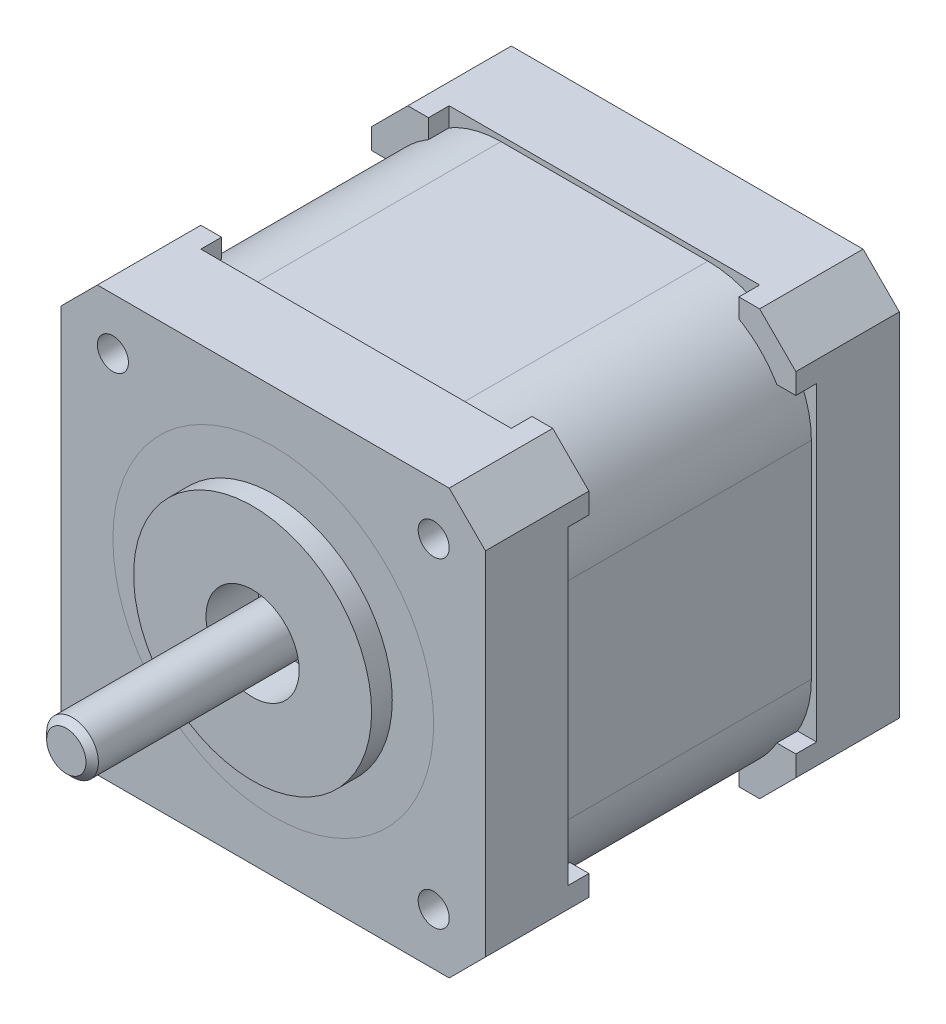
from build123d import *

# Parameters (mm, degrees)
SALIENTE_EXTRUIR1_DEPTH = 20
CORTAR_EXTRUIR1_START   = -8
CROQUIS2_W              = 30
CROQUIS2_H              = 5.5
CROQUIS2_H_2            = 30
CROQUIS2_W_2            = 5.5
CORTAR_EXTRUIR1_DEPTH   = 24
CORTAR_EXTRUIR2_START   = -10
CORTAR_EXTRUIR2_DEPTH   = 20
CORTAR_EXTRUIR3_START   = -32
CORTAR_EXTRUIR3_DEPTH   = 24
SALIENTE_EXTRUIR2_START = -32
SALIENTE_EXTRUIR2_DEPTH = 24
CROQUIS5_R              = 15.5
CROQUIS5_R_2            = 11.5
CROQUIS5_R_3            = 4.5
CROQUIS5_R_4            = 2.5
CORTAR_EXTRUIR4_DEPTH   = 3
SALIENTE_EXTRUIR3_REACH = 51.401
CROQUIS5_3_R            = 15.5
CROQUIS5_3_R_2          = 11.5
SALIENTE_EXTRUIR4_START = -3
CROQUIS5_4_R            = 11.5
CROQUIS5_4_R_2          = 4.5
SALIENTE_EXTRUIR4_DEPTH = 5
SALIENTE_EXTRUIR5_START = -3
CROQUIS5_5_R            = 2.5
SALIENTE_EXTRUIR5_DEPTH = 23
CHAFL_N1_SIZE           = 0.6
CROQUIS6_R              = 1.5
CORTAR_EXTRUIR5_DEPTH   = 6


with BuildPart() as part:
    # Croquis1 → Saliente-Extruir1 (new, symmetric)
    with BuildSketch(Plane.XY):
        Polygon((-17, 20.5), (-20.5, 17), (-20.5, -17), (-17, -20.5), (17, -20.5), (20.5, -17), (20.5, 17), (17, 20.5), align=None)
    extrude(amount=SALIENTE_EXTRUIR1_DEPTH, both=True)

    # Croquis2 → Cortar-Extruir1 (cut)
    with BuildSketch(Plane.XY.offset(20).offset(CORTAR_EXTRUIR1_START)):
        with Locations((0, 17.75)):
            Rectangle(CROQUIS2_W, CROQUIS2_H)
        Rectangle(CROQUIS2_W, CROQUIS2_H_2)
        with Locations((17.75, 0)):
            Rectangle(CROQUIS2_W_2, CROQUIS2_H_2)
        with Locations((0, -17.75)):
            Rectangle(CROQUIS2_W, CROQUIS2_H)
        with Locations((-17.75, 0)):
            Rectangle(CROQUIS2_W_2, CROQUIS2_H_2)
    extrude(amount=-CORTAR_EXTRUIR1_DEPTH, mode=Mode.SUBTRACT)

    # Croquis3 → Cortar-Extruir2 (cut)
    with BuildSketch(Plane(origin=(0, 0, -20), x_dir=(-1, 0, 0), z_dir=(0, 0, -1)).offset(CORTAR_EXTRUIR2_START)):
        Polygon((-17, 20.5), (-20.5, 17), (-20.5, -17), (-17, -20.5), (17, -20.5), (20.5, -17), (20.5, 17), (17, 20.5), align=None)
    extrude(amount=-CORTAR_EXTRUIR2_DEPTH, mode=Mode.SUBTRACT)


with BuildPart() as cortar_extruir2_piece_1:
    # of the separate pieces the step leaves, piece 1, a body of its own (cortar_extruir2_pieces)
    add(part.part.solids().sort_by_distance((-17, 20.5, -10))[0])


with BuildPart() as cortar_extruir2_piece_2:
    # of the separate pieces the step leaves, piece 2, a body of its own (cortar_extruir2_pieces)
    add(part.part.solids().sort_by_distance((-17, 20.5, 20))[0])


with BuildPart() as cortar_extruir3_tool:
    # Croquis4<4> → Cortar-Extruir3 (new body)
    with BuildSketch(Plane.XY.offset(20).offset(CORTAR_EXTRUIR3_START)):
        with BuildLine():
            Line((-20, 10), (-20, -10))
            ThreePointArc((-20, -10), (-17.071067812, -17.071067812), (-10, -20))
            Line((-10, -20), (10, -20))
            ThreePointArc((10, -20), (17.071067812, -17.071067812), (20, -10))
            Line((20, -10), (20, 10))
            ThreePointArc((20, 10), (17.071067812, 17.071067812), (10, 20))
            Line((10, 20), (-10, 20))
            ThreePointArc((-10, 20), (-17.071067812, 17.071067812), (-20, 10))
        make_face()
    extrude(amount=CORTAR_EXTRUIR3_DEPTH)


with BuildPart() as cortar_extruir2_piece_1_1:
    add(cortar_extruir2_piece_1.part)

    # Cortar-Extruir3: cut by cortar_extruir3_tool
    add(cortar_extruir3_tool.part, mode=Mode.SUBTRACT)


with BuildPart() as cortar_extruir2_piece_2_1:
    add(cortar_extruir2_piece_2.part)

    # Cortar-Extruir3: cut by cortar_extruir3_tool
    add(cortar_extruir3_tool.part, mode=Mode.SUBTRACT)

    # Croquis5 → Cortar-Extruir4 (cut)
    # profile 1 of 4: a face of its own
    with BuildSketch(Plane.XY.offset(20)):
        Circle(CROQUIS5_R)
        Circle(CROQUIS5_R_2, mode=Mode.SUBTRACT)
    # profile 2 of 4: a face of its own
    with BuildSketch(Plane.XY.offset(20)):
        Circle(CROQUIS5_R_2)
        Circle(CROQUIS5_R_3, mode=Mode.SUBTRACT)
    # profile 3 of 4: a face of its own
    with BuildSketch(Plane.XY.offset(20)):
        Circle(CROQUIS5_R_3)
        Circle(CROQUIS5_R_4, mode=Mode.SUBTRACT)
    # profile 4 of 4: a face of its own
    with BuildSketch(Plane.XY.offset(20)):
        Circle(CROQUIS5_R_4)
    extrude(amount=-CORTAR_EXTRUIR4_DEPTH, mode=Mode.SUBTRACT)


with BuildPart() as body_3:
    # Croquis4 → Saliente-Extruir2 (new body)
    with BuildSketch(Plane.XY.offset(20).offset(SALIENTE_EXTRUIR2_START)):
        with BuildLine():
            Line((-20, 10), (-20, -10))
            ThreePointArc((-20, -10), (-17.071067812, -17.071067812), (-10, -20))
            Line((-10, -20), (10, -20))
            ThreePointArc((10, -20), (17.071067812, -17.071067812), (20, -10))
            Line((20, -10), (20, 10))
            ThreePointArc((20, 10), (17.071067812, 17.071067812), (10, 20))
            Line((10, 20), (-10, 20))
            ThreePointArc((-10, 20), (-17.071067812, 17.071067812), (-20, 10))
        make_face()
    extrude(amount=SALIENTE_EXTRUIR2_DEPTH)


with BuildPart() as body_4:

    # Croquis5<3> → Saliente-Extruir3 (new, up to next)
    with BuildSketch(Plane.XY.offset(20), mode=Mode.PRIVATE) as saliente_extruir3_sk1:
        Circle(CROQUIS5_3_R)
        Circle(CROQUIS5_3_R_2, mode=Mode.SUBTRACT)
    saliente_extruir3_tool1 = extrude(saliente_extruir3_sk1.sketch, amount=-SALIENTE_EXTRUIR3_REACH, mode=Mode.PRIVATE) - cortar_extruir2_piece_2_1.part
    add(saliente_extruir3_tool1.solids().sort_by_distance((-15.061594, 0, 20))[0])

    # Croquis5<4> → Saliente-Extruir4 (add)
    with BuildSketch(Plane.XY.offset(20).offset(SALIENTE_EXTRUIR4_START)):
        Circle(CROQUIS5_4_R)
        Circle(CROQUIS5_4_R_2, mode=Mode.SUBTRACT)
    extrude(amount=SALIENTE_EXTRUIR4_DEPTH)


with BuildPart() as cortar_extruir2_piece_2_2:
    add(cortar_extruir2_piece_2_1.part)

    # Croquis5<5> → Saliente-Extruir5 (add)
    with BuildSketch(Plane.XY.offset(20).offset(SALIENTE_EXTRUIR5_START)):
        Circle(CROQUIS5_5_R)
    extrude(amount=SALIENTE_EXTRUIR5_DEPTH)

    # Chaflán1
    chafl_n1_edges = [cortar_extruir2_piece_2_2.edges().sort_by_distance(p)[0] for p in [
        (-2.5, 0, 40),
    ]]
    chamfer(chafl_n1_edges, length=CHAFL_N1_SIZE)

    # Croquis6 → Cortar-Extruir5 (cut)
    with BuildSketch(Plane.XY.offset(20)):
        with Locations((-15.5, -15.5)):
            Circle(CROQUIS6_R)
        with Locations((15.5, -15.5)):
            Circle(CROQUIS6_R)
        with Locations((15.5, 15.5)):
            Circle(CROQUIS6_R)
        with Locations((-15.5, 15.5)):
            Circle(CROQUIS6_R)
    extrude(amount=-CORTAR_EXTRUIR5_DEPTH, mode=Mode.SUBTRACT)


solid = Compound([cortar_extruir2_piece_1_1.part, body_3.part, body_4.part, cortar_extruir2_piece_2_2.part])
